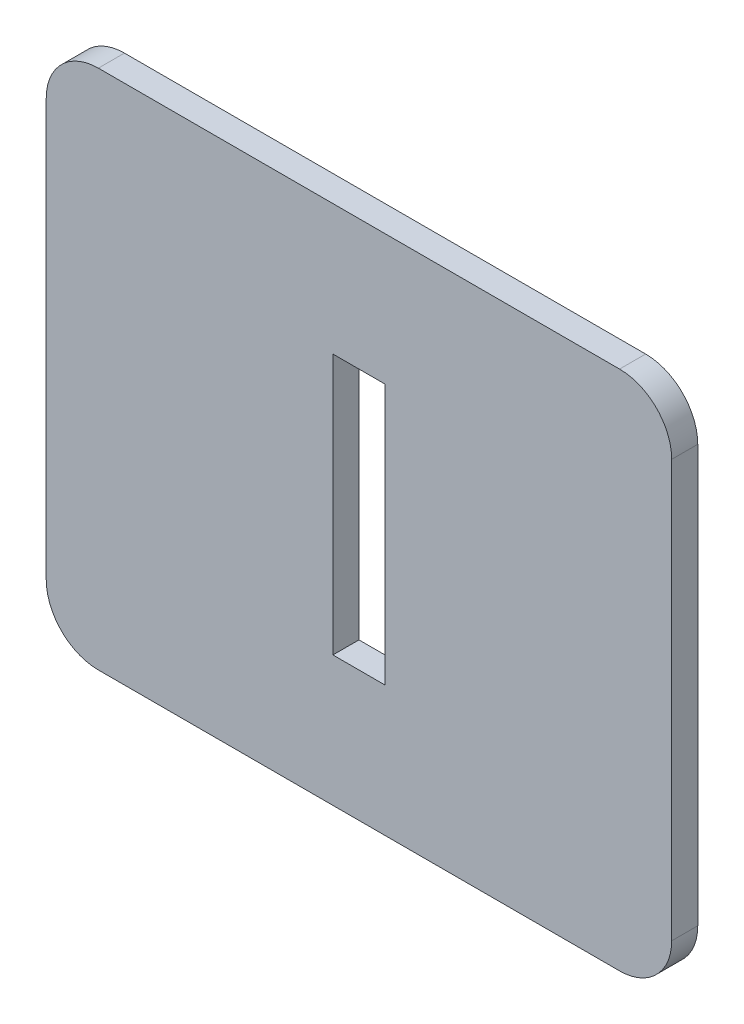
from build123d import *

# Parameters (mm, degrees)
SKETCH1_W           = 10
SKETCH1_H           = 50
BOSS_EXTRUDE1_DEPTH = 5


with BuildPart() as part:
    # Sketch1 → Boss-Extrude1 (new body)
    with BuildSketch(Plane.XY):
        with BuildLine():
            Line((10, 0), (110, 0))
            ThreePointArc((110, 0), (117.071067812, 2.928932188), (120, 10))
            Line((120, 10), (120, 90))
            ThreePointArc((120, 90), (117.071067812, 97.071067812), (110, 100))
            Line((110, 100), (10, 100))
            ThreePointArc((10, 100), (2.928932188, 97.071067812), (0, 90))
            Line((0, 90), (0, 10))
            ThreePointArc((0, 10), (2.928932188, 2.928932188), (10, 0))
        make_face()
        with Locations((60, 50)):
            Rectangle(SKETCH1_W, SKETCH1_H, mode=Mode.SUBTRACT)
    extrude(amount=BOSS_EXTRUDE1_DEPTH)


solid = part.part
